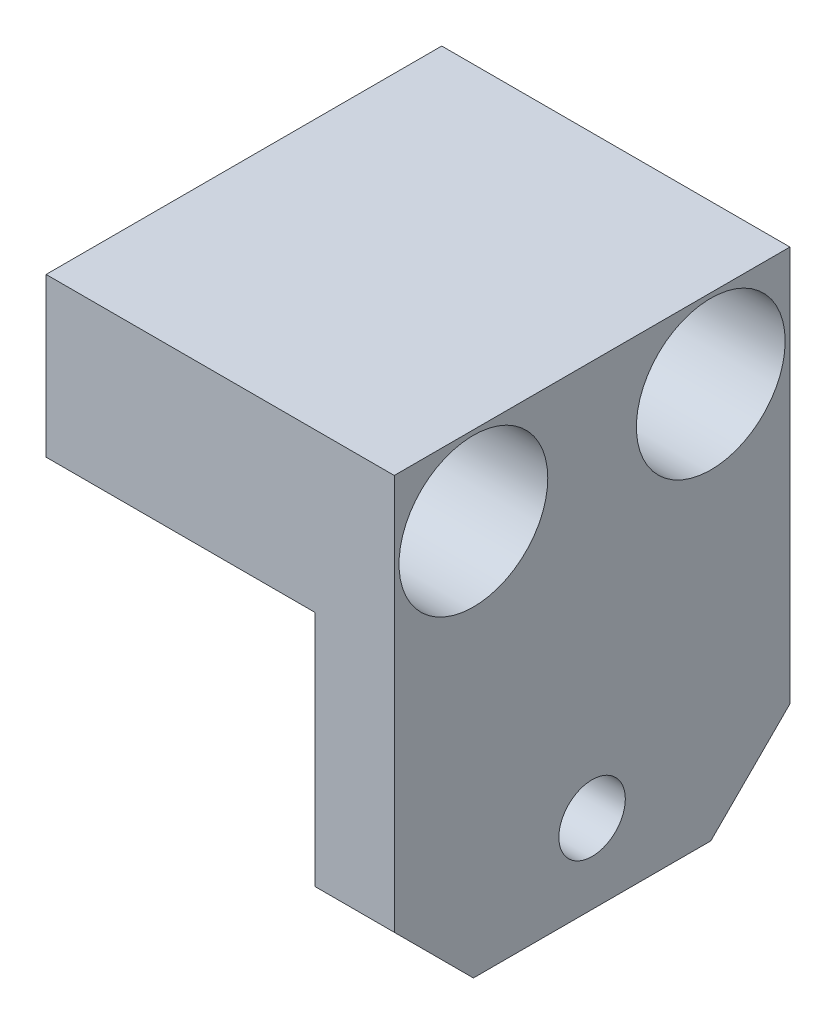
from build123d import *

# Parameters (mm, degrees)
SKETCH_2_W                = 22
SKETCH_2_H                = 30
EXTRUDE_1_DEPTH           = 12.5
SKETCH_3_W                = 17
SKETCH_3_H                = 20
CUT_EXTRUDE_1_DEPTH       = 32.160872902
HOLE_WIZARD_1_D           = 5.5
HOLE_WIZARD_1_CBORE_D     = 9.4
HOLE_WIZARD_1_CBORE_DEPTH = 7
HOLE_WIZARD_M5_1_D        = 4.2
CHAMFER_1_SIZE            = 5


with BuildPart() as part:
    # 草图2 → 凸台-拉伸1 (new, symmetric)
    with BuildSketch(Plane.XY):
        Rectangle(SKETCH_2_W, SKETCH_2_H)
    extrude(amount=EXTRUDE_1_DEPTH, both=True)

    # 草图3 → 切除-拉伸1 (cut, through all)
    with BuildSketch(Plane.XY.offset(12.5)):
        with Locations((-2.5, -5)):
            Rectangle(SKETCH_3_W, SKETCH_3_H)
    extrude(amount=-CUT_EXTRUDE_1_DEPTH, mode=Mode.SUBTRACT)

    # 打孔尺寸根据内六角圆柱头螺钉的类型1 (through all)
    with Locations(Plane(origin=(11, 0, 0), x_dir=(0, 0, -1), z_dir=(1, 0, 0))):
        with Locations((7.5, 10), (-7.5, 10)):
            CounterBoreHole(HOLE_WIZARD_1_D / 2, HOLE_WIZARD_1_CBORE_D / 2, HOLE_WIZARD_1_CBORE_DEPTH)

    # M5 螺纹孔1 (through all)
    with Locations(Plane(origin=(11, 0, 0), x_dir=(0, 0, -1), z_dir=(1, 0, 0))):
        with Locations((0, -10)):
            Hole(HOLE_WIZARD_M5_1_D / 2)

    # 倒角1
    chamfer_1_edges = [part.edges().sort_by_distance(p)[0] for p in [
        (8.5, -15, -12.5),
        (8.5, -15, 12.5),
    ]]
    chamfer(chamfer_1_edges, length=CHAMFER_1_SIZE)


solid = part.part
